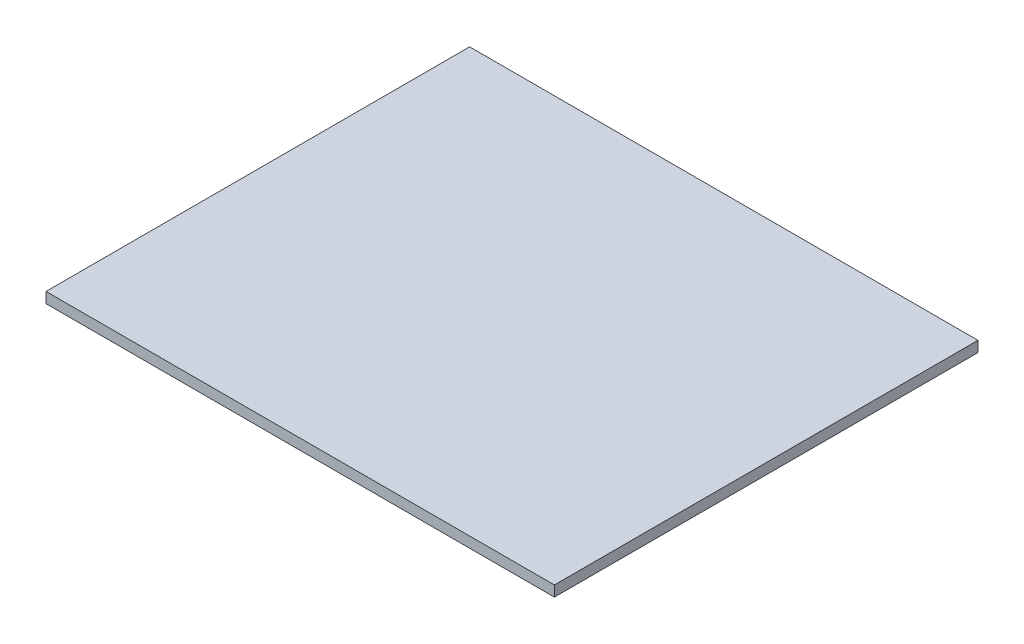
from build123d import *

# Parameters (mm, degrees)
SKETCH1_W           = 304.8
SKETCH1_H           = 254
BOSS_EXTRUDE1_DEPTH = 6.35


with BuildPart() as part:
    # Sketch1 → Boss-Extrude1 (new body)
    with BuildSketch(Plane(origin=(0, 0, 0), x_dir=(1, 0, 0), z_dir=(0, 1, 0))):
        Rectangle(SKETCH1_W, SKETCH1_H)
    extrude(amount=BOSS_EXTRUDE1_DEPTH)


solid = part.part
